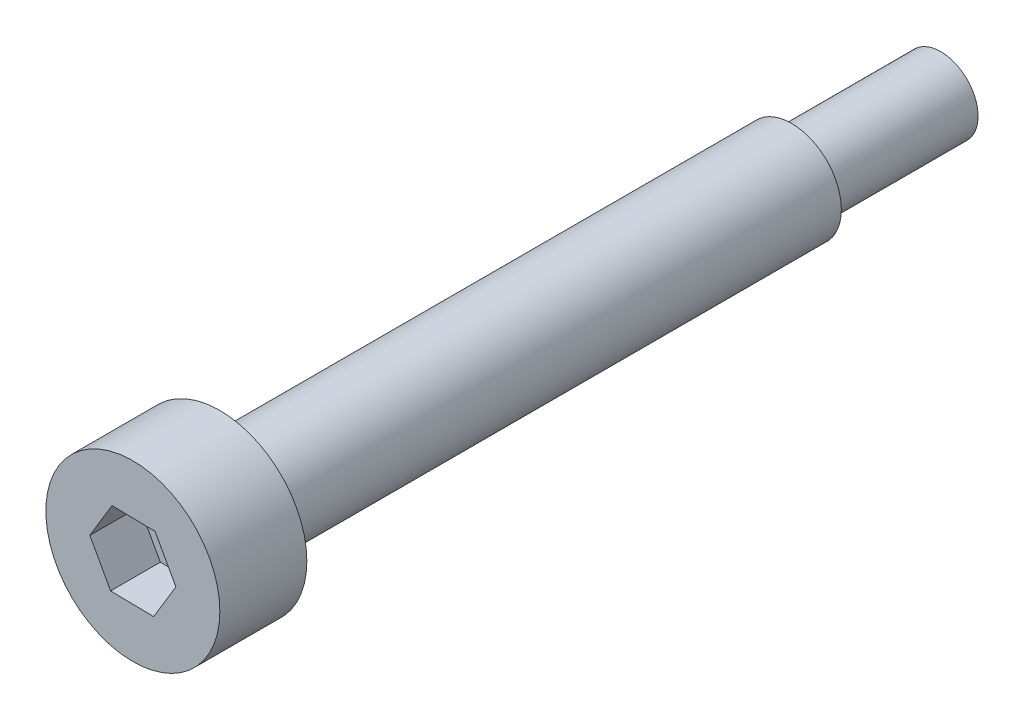
from build123d import *

# Parameters (mm, degrees)
SKETCH_1_R          = 3.5
EXTRUDE_1_DEPTH     = 3.5
CUT_EXTRUDE_1_DEPTH = 2
SKETCH_3_R          = 2
EXTRUDE_2_DEPTH     = 23
SKETCH_4_R          = 1.5
EXTRUDE_3_DEPTH     = 6


with BuildPart() as part:
    # 草图1 → 凸台-拉伸1 (new body)
    with BuildSketch(Plane.XY):
        Circle(SKETCH_1_R)
    extrude(amount=EXTRUDE_1_DEPTH)

    # 草图2 → 切除-拉伸1 (cut)
    with BuildSketch(Plane.XY.offset(3.5)):
        Polygon((0.893639487, 1.483714416), (-0.838114632, 1.515771705), (-1.731754119, 0.03205729), (-0.893639487, -1.483714416), (0.838114632, -1.515771705), (1.731754119, -0.03205729), align=None)
    extrude(amount=-CUT_EXTRUDE_1_DEPTH, mode=Mode.SUBTRACT)

    # 草图3 → 凸台-拉伸2 (add)
    with BuildSketch(Plane(origin=(0, 0, 0), x_dir=(-1, 0, 0), z_dir=(0, 0, -1))):
        with Locations(Location((0, 0, 0), (0, 0, 180))):
            Circle(SKETCH_3_R)
    extrude(amount=EXTRUDE_2_DEPTH)

    # 草图4 → 凸台-拉伸3 (add)
    with BuildSketch(Plane(origin=(0, 0, -23), x_dir=(-1, 0, 0), z_dir=(0, 0, -1))):
        Circle(SKETCH_4_R)
    extrude(amount=EXTRUDE_3_DEPTH)


solid = part.part
